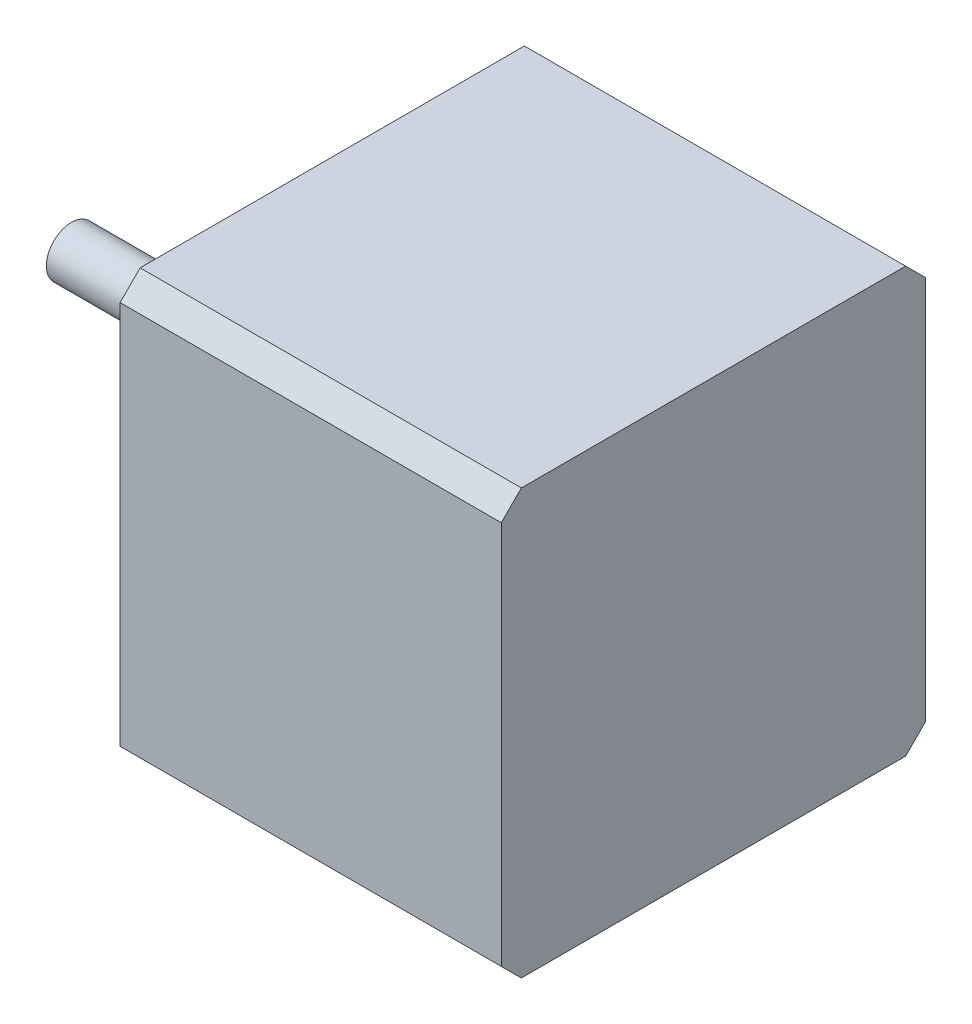
from build123d import *

# Parameters (mm, degrees)
EXTRUDE_2_DEPTH          = 38
SKETCH_2_R               = 11
EXTRUDE_3_DEPTH          = 2
FILLET_1_R               = 1
SKETCH_3_R               = 2.5
EXTRUDE_4_DEPTH          = 24
SKETCH_4_R               = 1.5
CUT_EXTRUDE_1_DEPTH      = 4.5
PATTERN_CIRCULAR_1_COUNT = 4


with BuildPart() as part:
    # 草图1 → 凸台-拉伸2 (new body)
    with BuildSketch(Plane(origin=(0, 0, 0), x_dir=(0, 0, -1), z_dir=(1, 0, 0))):
        Polygon((0, 40.3), (2, 42.3), (40.3, 42.3), (42.3, 40.3), (42.3, 2), (40.3, 0), (2, 0), (0, 2), align=None)
    extrude(amount=EXTRUDE_2_DEPTH)

    # 草图2 → 凸台-拉伸3 (add)
    with BuildSketch(Plane.ZY):
        with Locations((-21.15, 21.15)):
            Circle(SKETCH_2_R)
    extrude(amount=EXTRUDE_3_DEPTH)

    # 圆角1
    fillet_1_edges = [part.edges().sort_by_distance(p)[0] for p in [
        (-2, 21.15, -32.15),
    ]]
    fillet(fillet_1_edges, radius=FILLET_1_R)

    # 草图3 → 凸台-拉伸4 (add)
    with BuildSketch(Plane.ZY.offset(2)):
        with Locations((-21.15, 21.15)):
            Circle(SKETCH_3_R)
    extrude(amount=EXTRUDE_4_DEPTH)

    # 草图4 → 切除-拉伸1 (cut)
    with BuildSketch(Plane.ZY):
        with Locations((-36.65, 36.65)):
            Circle(SKETCH_4_R)
    cut_extrude_1 = extrude(amount=-CUT_EXTRUDE_1_DEPTH, mode=Mode.SUBTRACT)

    # 阵列(圆周)1: 切除-拉伸1 ×4 about axis
    pattern_circular_1_axis = Axis((0, 21.15, -21.15), (1, 0, 0))
    for i in range(1, PATTERN_CIRCULAR_1_COUNT):
        add(cut_extrude_1.rotate(pattern_circular_1_axis, i * 360 / PATTERN_CIRCULAR_1_COUNT), mode=Mode.SUBTRACT)


solid = part.part
